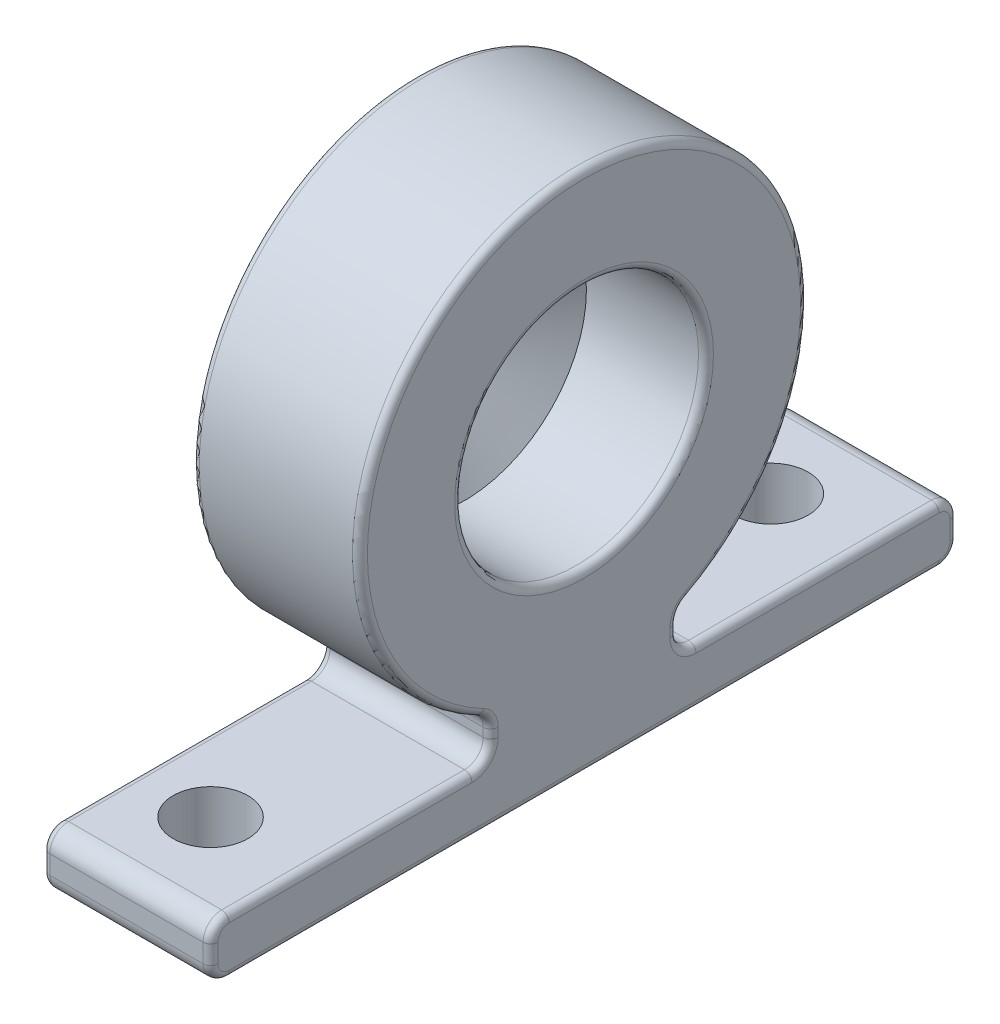
from build123d import *

# Parameters (mm, degrees)
EXTRUDE_1_DEPTH             = 4.5
SKETCH_2_R                  = 2
CUT_EXTRUDE_1_DEPTH         = 10
HOLE_WIZARD_5_16_18_1_D     = 6.5278
HOLE_WIZARD_5_16_18_1_DEPTH = 3.2
HOLE_WIZARD_5_16_18_1_TIP   = 1.961148974
CUT_EXTRUDE_2_REACH         = 18.628
SKETCH_5_R                  = 1
FILLET_1_R                  = 0.2


with BuildPart() as part:
    # 草图1 → 凸台-拉伸1 (new body)
    with BuildSketch(Plane(origin=(0, 0, 0), x_dir=(0, 0, -1), z_dir=(1, 0, 0))):
        with BuildLine():
            Line((-9.5, -6.5), (-3, -6.5))
            ThreePointArc((-3, -6.5), (-2.646446609, -6.353553391), (-2.5, -6))
            Line((-2.5, -6), (-2.5, -5.766281297))
            ThreePointArc((-2.5, -5.766281297), (-2.572574793, -5.506844037), (-2.769230769, -5.322721198))
            ThreePointArc((-2.769230769, -5.322721198), (0, 6), (2.769230769, -5.322721198))
            ThreePointArc((2.769230769, -5.322721198), (2.572574793, -5.506844037), (2.5, -5.766281297))
            Line((2.5, -5.766281297), (2.5, -6))
            ThreePointArc((2.5, -6), (2.646446609, -6.353553391), (3, -6.5))
            Line((3, -6.5), (9.5, -6.5))
            ThreePointArc((9.5, -6.5), (9.853553391, -6.646446609), (10, -7))
            Line((10, -7), (10, -7.5))
            ThreePointArc((10, -7.5), (9.853553391, -7.853553391), (9.5, -8))
            Line((9.5, -8), (-9.5, -8))
            ThreePointArc((-9.5, -8), (-9.853553391, -7.853553391), (-10, -7.5))
            Line((-10, -7.5), (-10, -7))
            ThreePointArc((-10, -7), (-9.853553391, -6.646446609), (-9.5, -6.5))
        make_face()
    extrude(amount=EXTRUDE_1_DEPTH)

    # 草图2 → 切除-拉伸1 (cut)
    with BuildSketch(Plane.ZY):
        Circle(SKETCH_2_R)
    extrude(amount=-CUT_EXTRUDE_1_DEPTH, mode=Mode.SUBTRACT)

    # 5/16-18 螺纹孔1
    with Locations(Plane(origin=(4.5, 0, 0), x_dir=(0, 0, -1), z_dir=(1, 0, 0))):
        with Locations((0, 0)):
            Hole(HOLE_WIZARD_5_16_18_1_D / 2, depth=HOLE_WIZARD_5_16_18_1_DEPTH)
            with Locations((0, 0, -(HOLE_WIZARD_5_16_18_1_DEPTH + HOLE_WIZARD_5_16_18_1_TIP / 2))):  # 118° drill point
                Cone(0, HOLE_WIZARD_5_16_18_1_D / 2, HOLE_WIZARD_5_16_18_1_TIP, mode=Mode.SUBTRACT)

    # 草图5 → 切除-拉伸2 (cut, up to next)
    with BuildSketch(Plane(origin=(0, -6.5, 0), x_dir=(1, 0, 0), z_dir=(0, 1, 0)), mode=Mode.PRIVATE) as cut_extrude_2_sk1:
        with Locations(Location((2, -7.5, 0), (0, 0, 270))):
            Circle(SKETCH_5_R)
    cut_extrude_2_tool1 = extrude(cut_extrude_2_sk1.sketch, amount=-CUT_EXTRUDE_2_REACH, mode=Mode.PRIVATE) & part.part
    # 草图5 → 切除-拉伸2 (cut, up to next)
    with BuildSketch(Plane(origin=(0, -6.5, 0), x_dir=(1, 0, 0), z_dir=(0, 1, 0)), mode=Mode.PRIVATE) as cut_extrude_2_sk2:
        with Locations(Location((2, 7.5, 0), (0, 0, 270))):
            Circle(SKETCH_5_R)
    cut_extrude_2_tool2 = extrude(cut_extrude_2_sk2.sketch, amount=-CUT_EXTRUDE_2_REACH, mode=Mode.PRIVATE) & part.part
    add(cut_extrude_2_tool1.solids().sort_by_distance((2, -6.5, 7.5))[0], mode=Mode.SUBTRACT)
    add(cut_extrude_2_tool2.solids().sort_by_distance((2, -6.5, -7.5))[0], mode=Mode.SUBTRACT)

    # 圆角1
    fillet_1_edges = [part.edges().sort_by_distance(p)[0] for p in [
        (4.5, -6.353553391, 2.646446609),
        (4.5, -6.5, 6.25),
        (0, 6, 0),
        (0, -5.506844037, -2.572574793),
        (0, -5.883140649, -2.5),
        (0, -6.353553391, -2.646446609),
        (0, -6.5, -6.25),
        (4.5, -6.646446609, 9.853553391),
        (0, -6.646446609, -9.853553391),
        (0, -7.25, -10),
        (0, -7.853553391, -9.853553391),
        (0, -8, 0),
        (0, -7.853553391, 9.853553391),
        (0, -7.25, 10),
        (0, -6.646446609, 9.853553391),
        (0, -6.5, 6.25),
        (4.5, -7.25, 10),
        (0, -6.353553391, 2.646446609),
        (0, -5.883140649, 2.5),
        (0, -5.506844037, 2.572574793),
        (4.5, -7.853553391, 9.853553391),
        (4.5, -8, 0),
        (4.5, -7.853553391, -9.853553391),
        (4.5, -7.25, -10),
        (4.5, -6.646446609, -9.853553391),
        (4.5, -6.5, -6.25),
        (4.5, -5.506844037, 2.572574793),
        (4.5, -6.353553391, -2.646446609),
        (4.5, -5.883140649, -2.5),
        (4.5, -5.506844037, -2.572574793),
        (0, 0, -2),
        (4.5, 6, 0),
        (4.5, 0, -3.2639),
        (4.5, -5.883140649, 2.5),
    ]]
    fillet(fillet_1_edges, radius=FILLET_1_R)


solid = part.part
